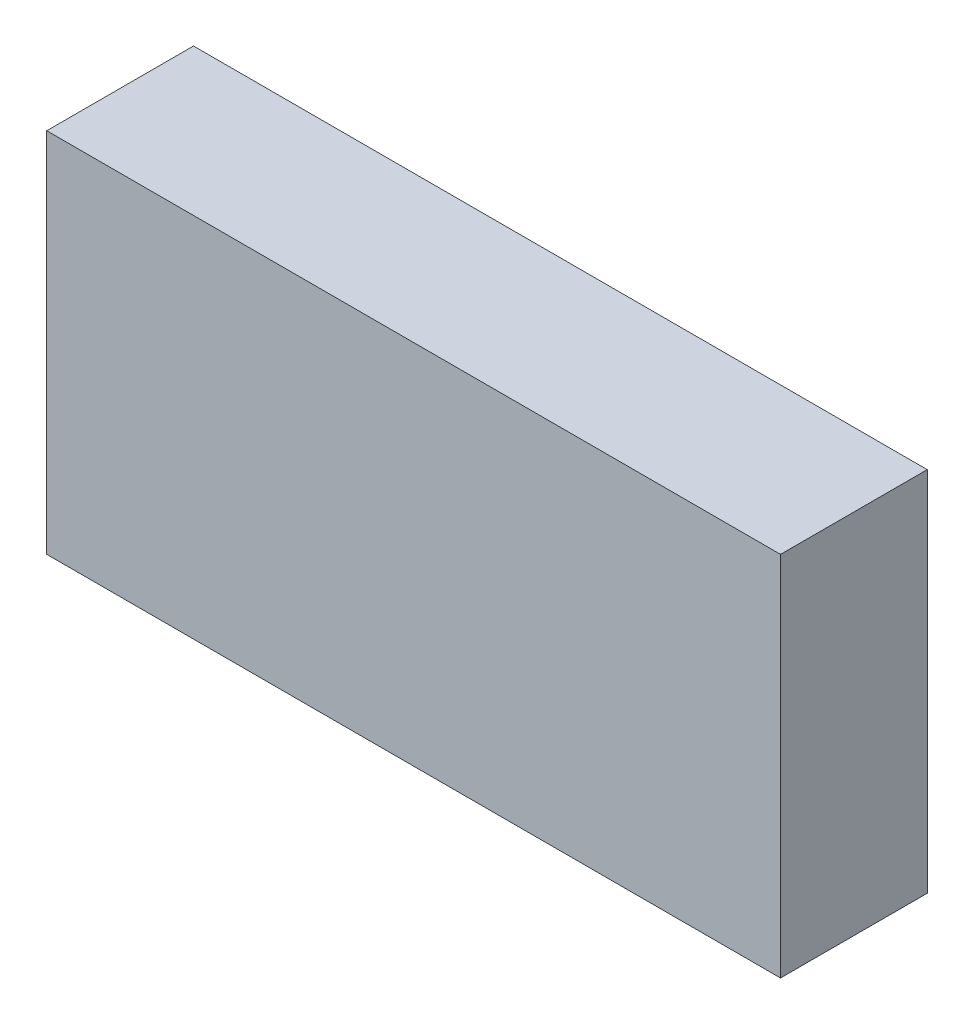
from build123d import *

# Parameters (mm, degrees)
TOPPING_SOG_KONDENSER_1_START = -240
SKETCH1_W                     = 300
SKETCH1_H                     = 150
TOPPING_SOG_KONDENSER_1_DEPTH = 60


with BuildPart() as part:
    # Sketch1 → TOPPING_sog_kondenser_1 (new body)
    with BuildSketch(Plane.XY.offset(TOPPING_SOG_KONDENSER_1_START)):
        with Locations((450, 105)):
            Rectangle(SKETCH1_W, SKETCH1_H)
    extrude(amount=-TOPPING_SOG_KONDENSER_1_DEPTH)


solid = part.part
